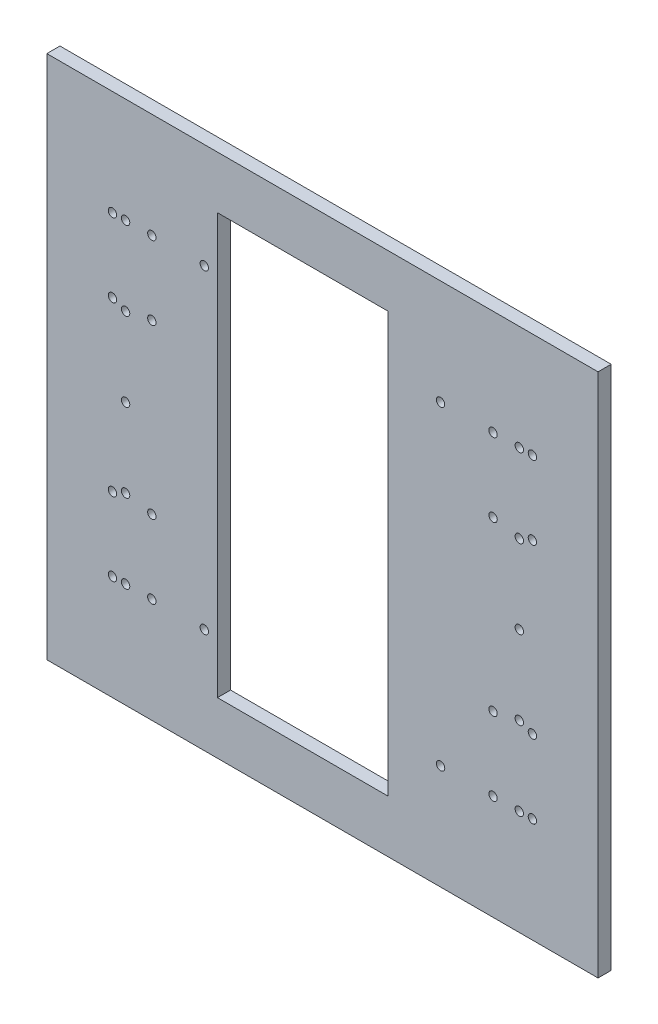
from build123d import *

# Parameters (mm, degrees)
SKETCH_2_W          = 210
SKETCH_2_H          = 200
SKETCH_2_R          = 1.6
SKETCH_2_W_2        = 65
SKETCH_2_H_2        = 160
EXTRUDE_1_DEPTH     = 5
SKETCH_5_R          = 1.6
CUT_EXTRUDE_1_DEPTH = 146.674130949


with BuildPart() as part:
    # 草图2 → 凸台-拉伸1 (new body)
    with BuildSketch(Plane.XY):
        with Locations((0.714384236, 0.102054891)):
            Rectangle(SKETCH_2_W, SKETCH_2_H)
        with Locations((-74.285615764, -59.897945109)):
            Circle(SKETCH_2_R, mode=Mode.SUBTRACT)
        with Locations((75.714384236, 60.102054891)):
            Circle(SKETCH_2_R, mode=Mode.SUBTRACT)
        with Locations((-74.285615764, 30.102054891)):
            Circle(SKETCH_2_R, mode=Mode.SUBTRACT)
        with Locations((-74.285615764, 0.102054891)):
            Circle(SKETCH_2_R, mode=Mode.SUBTRACT)
        with Locations((-74.285615764, -29.897945109)):
            Circle(SKETCH_2_R, mode=Mode.SUBTRACT)
        with Locations((-44.285615764, -59.897945109)):
            Circle(SKETCH_2_R, mode=Mode.SUBTRACT)
        with Locations((-44.285615764, 60.102054891)):
            Circle(SKETCH_2_R, mode=Mode.SUBTRACT)
        with Locations((45.714384236, 60.102054891)):
            Circle(SKETCH_2_R, mode=Mode.SUBTRACT)
        with Locations((75.714384236, -29.897945109)):
            Circle(SKETCH_2_R, mode=Mode.SUBTRACT)
        with Locations((75.714384236, 0.102054891)):
            Circle(SKETCH_2_R, mode=Mode.SUBTRACT)
        with Locations((45.714384236, -59.897945109)):
            Circle(SKETCH_2_R, mode=Mode.SUBTRACT)
        with Locations((75.714384236, 30.102054891)):
            Circle(SKETCH_2_R, mode=Mode.SUBTRACT)
        with Locations((75.714384236, -59.897945109)):
            Circle(SKETCH_2_R, mode=Mode.SUBTRACT)
        with Locations((-74.285615764, 60.102054891)):
            Circle(SKETCH_2_R, mode=Mode.SUBTRACT)
        with Locations((-6.785615764, 0.102054891)):
            Rectangle(SKETCH_2_W_2, SKETCH_2_H_2, mode=Mode.SUBTRACT)
    extrude(amount=EXTRUDE_1_DEPTH)

    # 草图5 → 切除-拉伸1 (cut, through all)
    with BuildSketch(Plane.XY.offset(5)):
        with BuildLine():
            Line((-79.285615764, 58.502054891), (-79.285615764, 60.102054891))
            Line((-79.285615764, 60.102054891), (-77.685615764, 60.102054891))
            ThreePointArc((-77.685615764, 60.102054891), (-80.416986614, 61.233425741), (-79.285615764, 58.502054891))
        make_face()
        with BuildLine():
            Line((-77.685615764, 60.102054891), (-79.285615764, 60.102054891))
            Line((-79.285615764, 60.102054891), (-79.285615764, 58.502054891))
            ThreePointArc((-79.285615764, 58.502054891), (-78.154244914, 58.970684041), (-77.685615764, 60.102054891))
        make_face()
        with BuildLine():
            ThreePointArc((-62.685615764, 60.102054891), (-64.285615764, 61.702054891), (-65.885615764, 60.102054891))
            Line((-65.885615764, 60.102054891), (-64.285615764, 60.102054891))
            Line((-64.285615764, 60.102054891), (-64.285615764, 58.502054891))
            ThreePointArc((-64.285615764, 58.502054891), (-63.154244914, 58.970684041), (-62.685615764, 60.102054891))
        make_face()
        with BuildLine():
            Line((-64.285615764, 60.102054891), (-65.885615764, 60.102054891))
            ThreePointArc((-65.885615764, 60.102054891), (-65.416986614, 58.970684041), (-64.285615764, 58.502054891))
            Line((-64.285615764, 58.502054891), (-64.285615764, 60.102054891))
        make_face()
        with BuildLine():
            ThreePointArc((-77.685615764, 32.102054891), (-78.154244914, 33.233425741), (-79.285615764, 33.702054891))
            Line((-79.285615764, 33.702054891), (-79.285615764, 32.102054891))
            Line((-79.285615764, 32.102054891), (-77.685615764, 32.102054891))
        make_face()
        with BuildLine():
            Line((-79.285615764, 32.102054891), (-79.285615764, 33.702054891))
            ThreePointArc((-79.285615764, 33.702054891), (-80.416986614, 30.970684041), (-77.685615764, 32.102054891))
            Line((-77.685615764, 32.102054891), (-79.285615764, 32.102054891))
        make_face()
        with BuildLine():
            ThreePointArc((-62.685615764, 32.102054891), (-63.154244914, 33.233425741), (-64.285615764, 33.702054891))
            Line((-64.285615764, 33.702054891), (-64.285615764, 32.102054891))
            Line((-64.285615764, 32.102054891), (-65.885615764, 32.102054891))
            ThreePointArc((-65.885615764, 32.102054891), (-64.285615764, 30.502054891), (-62.685615764, 32.102054891))
        make_face()
        with BuildLine():
            Line((-64.285615764, 32.102054891), (-64.285615764, 33.702054891))
            ThreePointArc((-64.285615764, 33.702054891), (-65.416986614, 33.233425741), (-65.885615764, 32.102054891))
            Line((-65.885615764, 32.102054891), (-64.285615764, 32.102054891))
        make_face()
        with BuildLine():
            Line((-79.285615764, -33.497945109), (-79.285615764, -31.897945109))
            Line((-79.285615764, -31.897945109), (-77.685615764, -31.897945109))
            ThreePointArc((-77.685615764, -31.897945109), (-80.416986614, -30.766574259), (-79.285615764, -33.497945109))
        make_face()
        with BuildLine():
            Line((-77.685615764, -31.897945109), (-79.285615764, -31.897945109))
            Line((-79.285615764, -31.897945109), (-79.285615764, -33.497945109))
            ThreePointArc((-79.285615764, -33.497945109), (-78.154244914, -33.029315959), (-77.685615764, -31.897945109))
        make_face()
        with BuildLine():
            ThreePointArc((-62.685615764, -31.897945109), (-64.285615764, -30.297945109), (-65.885615764, -31.897945109))
            Line((-65.885615764, -31.897945109), (-64.285615764, -31.897945109))
            Line((-64.285615764, -31.897945109), (-64.285615764, -33.497945109))
            ThreePointArc((-64.285615764, -33.497945109), (-63.154244914, -33.029315959), (-62.685615764, -31.897945109))
        make_face()
        with BuildLine():
            Line((-64.285615764, -31.897945109), (-65.885615764, -31.897945109))
            ThreePointArc((-65.885615764, -31.897945109), (-65.416986614, -33.029315959), (-64.285615764, -33.497945109))
            Line((-64.285615764, -33.497945109), (-64.285615764, -31.897945109))
        make_face()
        with BuildLine():
            ThreePointArc((-77.685615764, -59.897945109), (-78.154244914, -58.766574259), (-79.285615764, -58.297945109))
            Line((-79.285615764, -58.297945109), (-79.285615764, -59.897945109))
            Line((-79.285615764, -59.897945109), (-77.685615764, -59.897945109))
        make_face()
        with BuildLine():
            Line((-79.285615764, -59.897945109), (-79.285615764, -58.297945109))
            ThreePointArc((-79.285615764, -58.297945109), (-80.416986614, -61.029315959), (-77.685615764, -59.897945109))
            Line((-77.685615764, -59.897945109), (-79.285615764, -59.897945109))
        make_face()
        with BuildLine():
            ThreePointArc((-62.685615764, -59.897945109), (-63.154244914, -58.766574259), (-64.285615764, -58.297945109))
            Line((-64.285615764, -58.297945109), (-64.285615764, -59.897945109))
            Line((-64.285615764, -59.897945109), (-65.885615764, -59.897945109))
            ThreePointArc((-65.885615764, -59.897945109), (-64.285615764, -61.497945109), (-62.685615764, -59.897945109))
        make_face()
        with BuildLine():
            Line((-64.285615764, -59.897945109), (-64.285615764, -58.297945109))
            ThreePointArc((-64.285615764, -58.297945109), (-65.416986614, -58.766574259), (-65.885615764, -59.897945109))
            Line((-65.885615764, -59.897945109), (-64.285615764, -59.897945109))
        make_face()
        with Locations((65.714384236, -59.897945109)):
            Circle(SKETCH_5_R)
        with Locations((80.714384236, -59.897945109)):
            Circle(SKETCH_5_R)
        with Locations((65.714384236, -31.897945109)):
            Circle(SKETCH_5_R)
        with Locations((80.714384236, -31.897945109)):
            Circle(SKETCH_5_R)
        with Locations((80.714384236, 32.102054891)):
            Circle(SKETCH_5_R)
        with Locations((65.714384236, 32.102054891)):
            Circle(SKETCH_5_R)
        with Locations((65.714384236, 60.102054891)):
            Circle(SKETCH_5_R)
        with Locations((80.714384236, 60.102054891)):
            Circle(SKETCH_5_R)
    extrude(amount=-CUT_EXTRUDE_1_DEPTH, mode=Mode.SUBTRACT)


solid = part.part
